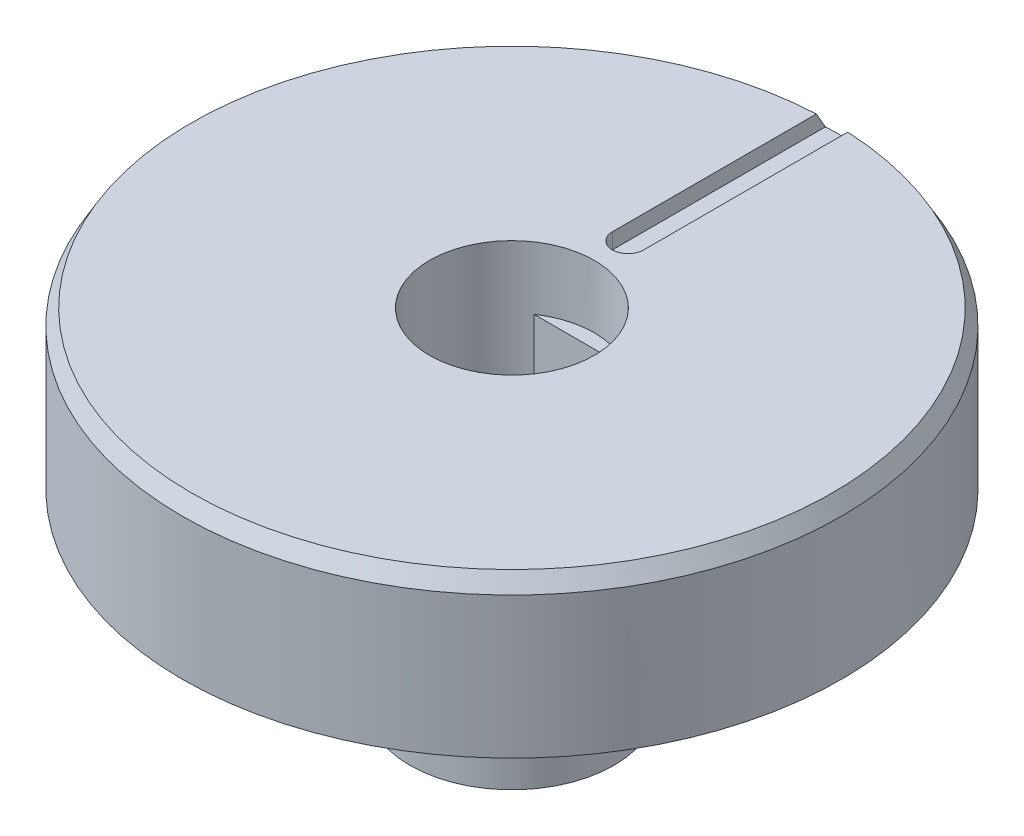
from build123d import *
from build123d.topology import SkipClean

# Parameters (mm, degrees)
SKETCH1_R           = 10.5
SKETCH1_R_2         = 8.6
BOSS_EXTRUDE1_DEPTH = 4
BOSS_EXTRUDE2_DEPTH = 1.25
BOSS_EXTRUDE3_START = 17.2
BOSS_EXTRUDE3_DEPTH = 1.25
BOSS_EXTRUDE4_START = 1
SKETCH3_R           = 10.5
BOSS_EXTRUDE4_DEPTH = 1
SKETCH5_R           = 3.25
BOSS_EXTRUDE5_DEPTH = 10
FILLET2_R           = 0.75
CUT_EXTRUDE1_DEPTH  = 5.25
FILLET1_R           = 0.25
SKETCH7_R           = 2.625
CUT_EXTRUDE2_DEPTH  = 2
CUT_EXTRUDE3_DEPTH  = 0.5
CUT_EXTRUDE4_DEPTH  = 4
CHAMFER2_SIZE       = 0.25
CHAMFER3_SIZE       = 0.5
CHAMFER3_SIZE2      = 0.288675135


with BuildPart() as part:
    # Sketch1 → Boss-Extrude1 (new body)
    with BuildSketch(Plane(origin=(0, 0, 0), x_dir=(1, 0, 0), z_dir=(0, 1, 0))):
        with Locations(Location((0, 0, 0), (0, 0, 270))):
            Circle(SKETCH1_R)
        with Locations(Location((0, 0, 0), (0, 0, 270))):
            Circle(SKETCH1_R_2, mode=Mode.SUBTRACT)
    extrude(amount=-BOSS_EXTRUDE1_DEPTH)

    # Sketch2 → Boss-Extrude2 (add)
    with BuildSketch(Plane(origin=(0, 0, 8.6), x_dir=(-1, 0, 0), z_dir=(0, 0, -1))):
        Polygon((0.4, -3.75), (-0.4, -3.75), (-0.4, -1.9), (-2.3, 0), (2.3, 0), (0.4, -1.9), align=None)
    extrude(amount=BOSS_EXTRUDE2_DEPTH)

    # Sketch2<2> → Boss-Extrude3 (add)
    with BuildSketch(Plane(origin=(0, 0, 8.6), x_dir=(-1, 0, 0), z_dir=(0, 0, -1)).offset(BOSS_EXTRUDE3_START)):
        Polygon((0.4, -3.75), (-0.4, -3.75), (-0.4, -1.9), (-2.3, 0), (2.3, 0), (0.4, -1.9), align=None)
    extrude(amount=-BOSS_EXTRUDE3_DEPTH)

    # Sketch3 → Boss-Extrude4 (add)
    with BuildSketch(Plane(origin=(0, 0, 0), x_dir=(1, 0, 0), z_dir=(0, 1, 0)).offset(BOSS_EXTRUDE4_START)):
        with Locations(Location((0, 0, 0), (0, 0, 270))):
            Circle(SKETCH3_R)
    extrude(amount=-BOSS_EXTRUDE4_DEPTH)

    # Sketch5 → Boss-Extrude5 (add)
    with BuildSketch(Plane.XZ):
        with Locations(Location((0, 0, 0), (0, 0, 90))):
            Circle(SKETCH5_R)
    extrude(amount=BOSS_EXTRUDE5_DEPTH)

    # Fillet2
    fillet2_edges = [part.edges().sort_by_distance(p)[0] for p in [
        (0, 0, -3.25),
    ]]
    fillet(fillet2_edges, radius=FILLET2_R)

    # Sketch4 → Cut-Extrude1 (cut)
    with BuildSketch(Plane(origin=(0, 1, 0), x_dir=(1, 0, 0), z_dir=(0, 1, 0))):
        with BuildLine():
            Line((-1.469693846, 2.175), (1.469693846, 2.175))
            ThreePointArc((1.469693846, 2.175), (0, -2.625), (-1.469693846, 2.175))
        make_face()
    extrude(amount=-CUT_EXTRUDE1_DEPTH, mode=Mode.SUBTRACT)

    # Fillet1
    fillet1_edges = [part.edges().sort_by_distance(p)[0] for p in [
        (-0.4, -3.75, 7.970346319),
        (0.4, -3.75, 7.970346319),
        (-0.4, -3.75, -7.970346319),
        (0.4, -3.75, -7.970346319),
    ]]
    fillet(fillet1_edges, radius=FILLET1_R)

    # Sketch7 → Cut-Extrude2 (cut)
    with SkipClean():  # the faces are left unmerged after this step: merging them gives an invalid solid
        with BuildSketch(Plane(origin=(0, 1, 0), x_dir=(1, 0, 0), z_dir=(0, 1, 0))):
            with Locations(Location((0, 0, 0), (0, 0, 270))):
                Circle(SKETCH7_R)
        extrude(amount=-CUT_EXTRUDE2_DEPTH, mode=Mode.SUBTRACT)

    # Sketch9 → Cut-Extrude3 (cut)
    with SkipClean():  # the faces are left unmerged after this step: merging them gives an invalid solid
        with BuildSketch(Plane(origin=(0, 1, 0), x_dir=(1, 0, 0), z_dir=(0, 1, 0))):
            with BuildLine():
                Line((-0.5, 3.7), (-0.5, 13.7))
                ThreePointArc((-0.5, 13.7), (0, 14.2), (0.5, 13.7))
                Line((0.5, 13.7), (0.5, 3.7))
                ThreePointArc((0.5, 3.7), (0, 3.2), (-0.5, 3.7))
            make_face()
        extrude(amount=-CUT_EXTRUDE3_DEPTH, mode=Mode.SUBTRACT)

    # Sketch10 → Cut-Extrude4 (cut)
    with SkipClean():  # the faces are left unmerged after this step: merging them gives an invalid solid
        with BuildSketch(Plane.XZ.offset(10)):
            Polygon((1.804219591, 0), (0.902109796, 1.5625), (-0.902109796, 1.5625), (-1.804219591, 0), (-0.902109796, -1.5625), (0.902109796, -1.5625), align=None)
        extrude(amount=-CUT_EXTRUDE4_DEPTH, mode=Mode.SUBTRACT)

    # Chamfer2
    chamfer2_edges = [part.edges().sort_by_distance(p)[0] for p in [
        (1.353164693, -10, -0.78125),
        (1.353164693, -10, 0.78125),
        (0, -10, 1.5625),
        (-1.353164693, -10, 0.78125),
        (-1.353164693, -10, -0.78125),
        (0, -10, -1.5625),
    ]]
    chamfer(chamfer2_edges, length=CHAMFER2_SIZE)

    # Chamfer3
    chamfer3_edges = [part.edges().sort_by_distance(p)[0] for p in [
        (-10.497021698, 1, 0.250070932),
    ]]
    chamfer3_side = [part.faces().sort_by_distance(p)[0] for p in [
        (0, -1.5, -10.5),
    ]]
    chamfer(chamfer3_edges, length=CHAMFER3_SIZE, length2=CHAMFER3_SIZE2, reference=chamfer3_side[0])


solid = part.part
